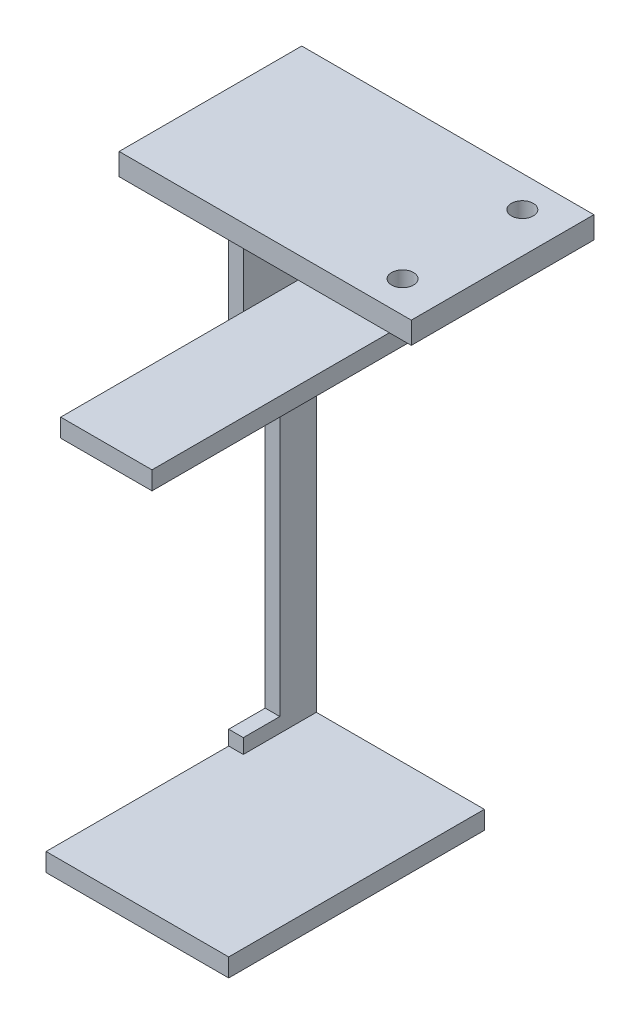
from build123d import *

# Parameters (mm, degrees)
SKETCH1_W           = 40
SKETCH1_H           = 25
SKETCH1_R           = 1.5
BOSS_EXTRUDE1_DEPTH = 3
SKETCH2_W           = 2
SKETCH2_H           = 10
BOSS_EXTRUDE2_DEPTH = 75
SKETCH6_W           = 25
SKETCH6_H           = 35
BOSS_EXTRUDE3_DEPTH = 2.5
SKETCH7_W           = 35
SKETCH7_H           = 2.5
BOSS_EXTRUDE4_DEPTH = 12.5
SKETCH8_W           = 5
SKETCH8_H           = 46
CUT_EXTRUDE2_DEPTH  = 90.862394805


with BuildPart() as part:
    # Sketch1 → Boss-Extrude1 (new body)
    with BuildSketch(Plane(origin=(0, 0, 0), x_dir=(1, 0, 0), z_dir=(0, 1, 0))):
        with Locations((-20, 12.5)):
            Rectangle(SKETCH1_W, SKETCH1_H)
        with Locations(Location((-5.5, 20.7, 0), (0, 0, 270))):
            Circle(SKETCH1_R, mode=Mode.SUBTRACT)
        with Locations(Location((-5.5, 4.3, 0), (0, 0, 270))):
            Circle(SKETCH1_R, mode=Mode.SUBTRACT)
    extrude(amount=BOSS_EXTRUDE1_DEPTH)

    # Sketch2 → Boss-Extrude2 (add)
    with BuildSketch(Plane.XZ):
        with Locations((-39, -20)):
            Rectangle(SKETCH2_W, SKETCH2_H)
    extrude(amount=BOSS_EXTRUDE2_DEPTH)

    # Sketch6 → Boss-Extrude3 (add)
    with BuildSketch(Plane.XZ.offset(75)):
        with Locations((-27.5, -7.5)):
            Rectangle(SKETCH6_W, SKETCH6_H)
    extrude(amount=BOSS_EXTRUDE3_DEPTH)

    # Sketch7 → Boss-Extrude4 (add)
    with BuildSketch(Plane(origin=(-38, 0, 0), x_dir=(0, 0, -1), z_dir=(1, 0, 0))):
        with Locations((7.5, -23.75)):
            Rectangle(SKETCH7_W, SKETCH7_H)
    extrude(amount=BOSS_EXTRUDE4_DEPTH)

    # Sketch8 → Cut-Extrude2 (cut, through all)
    with BuildSketch(Plane(origin=(-38, 0, 0), x_dir=(0, 0, -1), z_dir=(1, 0, 0))):
        with Locations((17.5, -50)):
            Rectangle(SKETCH8_W, SKETCH8_H)
    extrude(amount=-CUT_EXTRUDE2_DEPTH, mode=Mode.SUBTRACT)


solid = part.part
